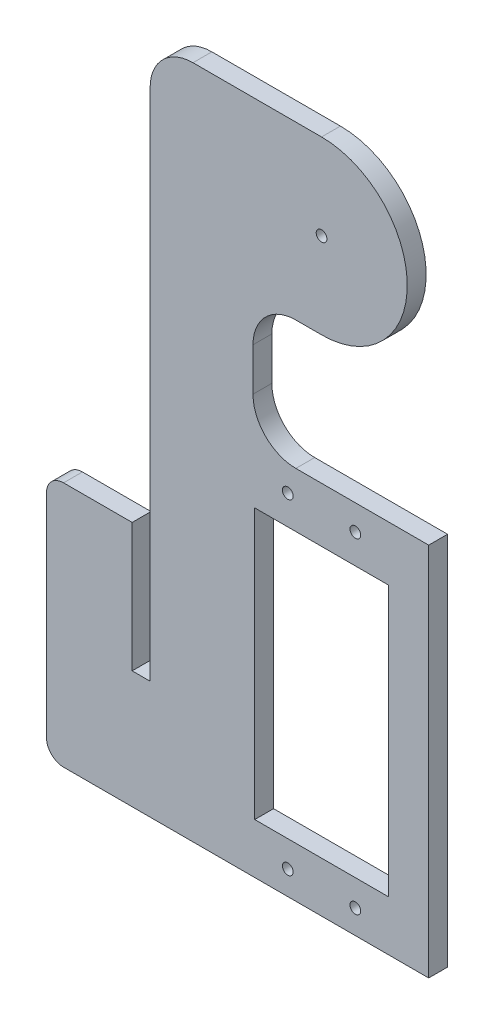
from build123d import *

# Parameters (mm, degrees)
SKETCH1_R           = 0.79375
SKETCH1_W           = 19.812
SKETCH1_H           = 40
BOSS_EXTRUDE1_DEPTH = 2.794
FILLET1_R           = 6.35
FILLET2_R           = 6.35
FILLET5_R           = 2.54


with BuildPart() as part:
    # Sketch1 → Boss-Extrude1 (new body)
    with BuildSketch(Plane.XY):
        with BuildLine():
            Line((-5.842, 4.734159763), (50.8, 4.734159763))
            Line((50.8, 4.734159763), (50.8, 36.343152622))
            Line((50.8, 36.343152622), (50.8, 60.284785263))
            Line((50.8, 60.284785263), (24.765, 60.284785263))
            Line((24.765, 60.284785263), (24.765, 79.327185263))
            Line((24.765, 79.327185263), (34.925, 79.327185263))
            ThreePointArc((34.925, 79.327185263), (47.625, 92.027185263), (34.925, 104.727185263))
            Line((34.925, 104.727185263), (9.525, 104.727185263))
            Line((9.525, 104.727185263), (9.525, 38.1))
            Line((9.525, 38.1), (9.525, 22.177185263))
            Line((9.525, 22.177185263), (6.858, 22.177185263))
            Line((6.858, 22.177185263), (6.858, 41.227185263))
            Line((6.858, 41.227185263), (-5.842, 41.227185263))
            Line((-5.842, 41.227185263), (-5.842, 4.734159763))
        make_face()
        with Locations((34.925, 92.027185263)):
            Circle(SKETCH1_R, mode=Mode.SUBTRACT)
        with Locations((29.9212, 8.283385263)):
            Circle(SKETCH1_R, mode=Mode.SUBTRACT)
        with Locations((39.9288, 8.283385263)):
            Circle(SKETCH1_R, mode=Mode.SUBTRACT)
        with Locations((29.9212, 56.517985263)):
            Circle(SKETCH1_R, mode=Mode.SUBTRACT)
        with Locations((39.9288, 56.517985263)):
            Circle(SKETCH1_R, mode=Mode.SUBTRACT)
        with Locations((34.925, 32.177185263)):
            Rectangle(SKETCH1_W, SKETCH1_H, mode=Mode.SUBTRACT)
    extrude(amount=BOSS_EXTRUDE1_DEPTH)

    # Fillet1
    fillet1_edges = [part.edges().sort_by_distance(p)[0] for p in [
        (24.765, 79.327185263, 1.397),
        (24.765, 60.284785263, 1.397),
    ]]
    fillet(fillet1_edges, radius=FILLET1_R)

    # Fillet2
    fillet2_edges = [part.edges().sort_by_distance(p)[0] for p in [
        (9.525, 104.727185263, 1.397),
    ]]
    fillet(fillet2_edges, radius=FILLET2_R)

    # Fillet5
    fillet5_edges = [part.edges().sort_by_distance(p)[0] for p in [
        (-5.842, 4.734159763, 1.397),
        (-5.842, 41.227185263, 1.397),
    ]]
    fillet(fillet5_edges, radius=FILLET5_R)


solid = part.part
